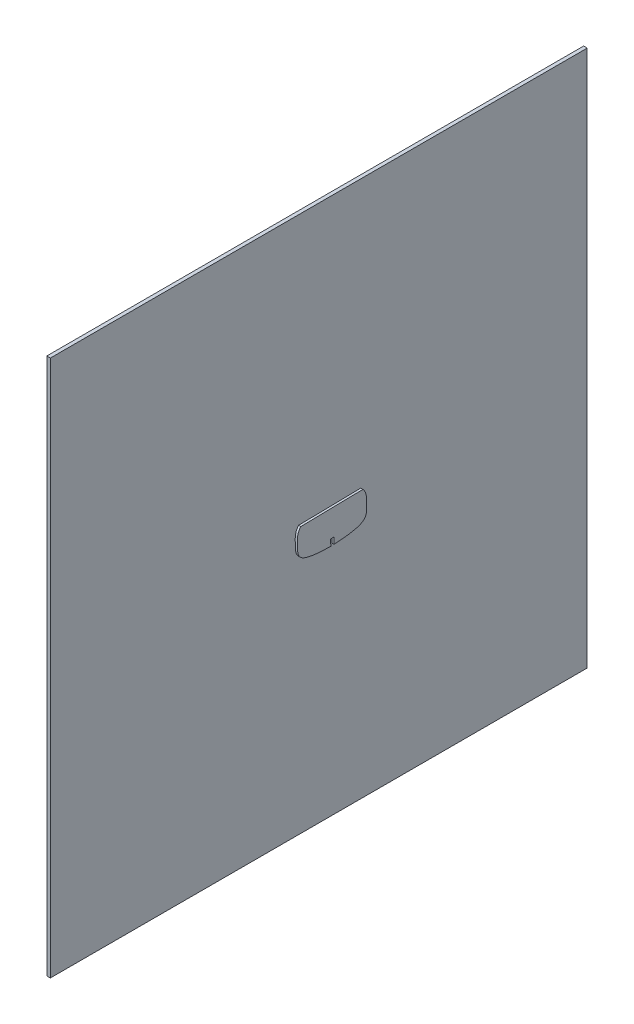
from build123d import *

# Parameters (mm, degrees)
BOSS_EXTRU_2_DEPTH      = 10
BOSS_EXTRU_3_DEPTH      = 6
ENL_V_MAT_EXTRU_1_DEPTH = 10


with BuildPart() as part:
    # Esquisse3D1 → Boss.-Extru.2 (new body)
    with BuildSketch(Plane(origin=(-20, 1121.289346724, 777.274991403), x_dir=(0, -0.7071067811865476, -0.7071067811865476), z_dir=(1, 0, 0))):
        Polygon((0, 0), (1060.66017178, 1060.66017178), (2121.32034356, 0), (1060.66017178, -1060.66017178), align=None)
    extrude(amount=BOSS_EXTRU_2_DEPTH)


with BuildPart() as body_2:
    # Esquisse5 → Boss.-Extru.3 (new body)
    with BuildSketch(Plane(origin=(0, 0, 0), x_dir=(0, 0, -1), z_dir=(1, 0, 0))):
        with BuildLine():
            Line((-93.755345908, 379.77774717), (79.938710943, 382.924280537))
            add(Edge.make_bspline(
                [(79.938710943, 382.924280537), (108.216840261, 351.133713236), (60.764258189, 328.313918745), (143.438885638, 296.978083527), (-5.253315798, 289.992072674)],
                knots=[0, 0, 0, 0, 0, 1, 1, 1, 1, 1], degree=4))
            add(Edge.make_bspline(
                [(-93.755345908, 379.77774717), (-120.863503042, 346.983836395), (-72.615548345, 325.897693232), (-154.100982944, 291.588036559), (-5.253315798, 289.992072674)],
                knots=[0, 0, 0, 0, 0, 1, 1, 1, 1, 1], degree=4))
        make_face()
    extrude(amount=BOSS_EXTRU_3_DEPTH)

    # Esquisse6 → Enlèv. mat.-Extru.1 (cut)
    with BuildSketch(Plane(origin=(6, 0, 0), x_dir=(0, 0, -1), z_dir=(1, 0, 0))):
        Polygon((-9.755892135, 290.052771706), (-10.081968925, 308.052771706), (-1.081968925, 308.215810101), (-0.755892135, 290.215810101), (9.798309297, 280.709423004), (-13.542023743, 279.203595066), align=None)
    extrude(amount=-ENL_V_MAT_EXTRU_1_DEPTH, mode=Mode.SUBTRACT)


solid = Compound([part.part, body_2.part])
